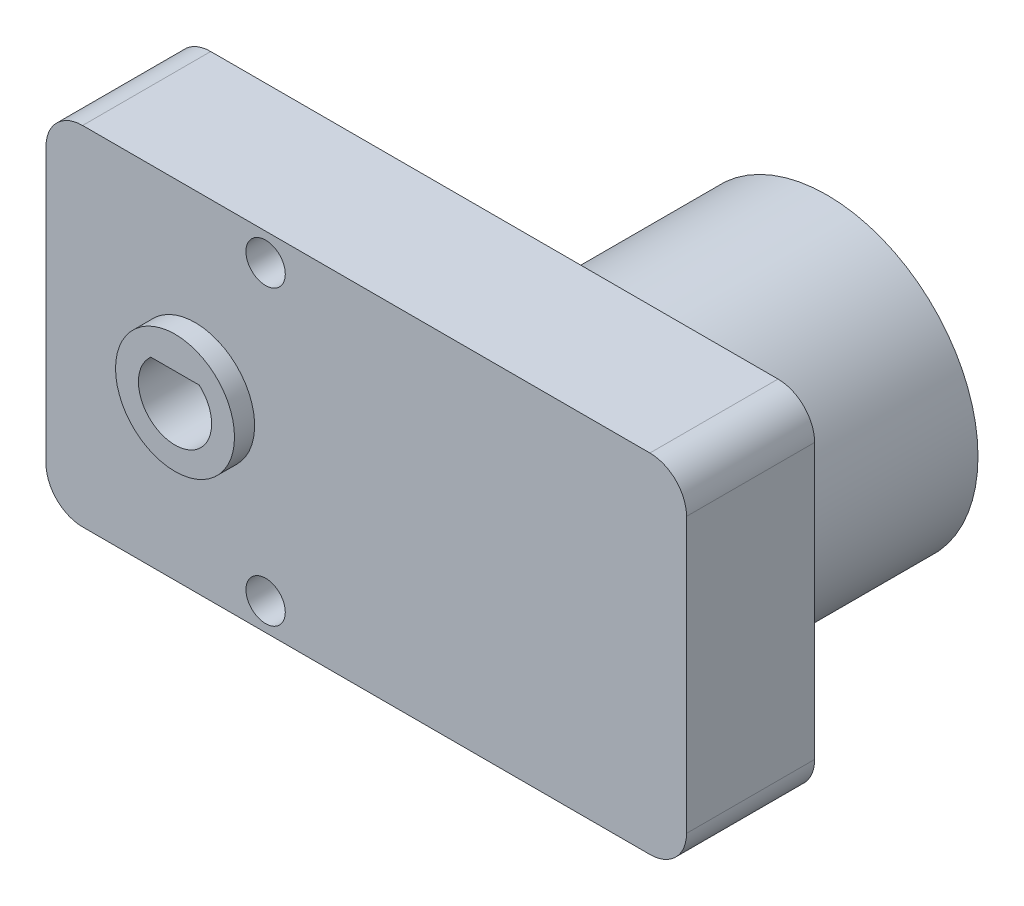
from build123d import *

# Parameters (mm, degrees)
SKETCH1_W           = 70
SKETCH1_H           = 38
SKETCH1_R           = 2.15
BOSS_EXTRUDE1_DEPTH = 14
FILLET1_R           = 4
SKETCH2_R           = 16.5
BOSS_EXTRUDE2_DEPTH = 22.6
BOSS_EXTRUDE3_START = 2.2
SKETCH3_R           = 6.5
BOSS_EXTRUDE3_DEPTH = 2.2
SKETCH4_R           = 6.5
BOSS_EXTRUDE4_DEPTH = 2.2


with BuildPart() as part:
    # Sketch1 → Boss-Extrude1 (new body)
    with BuildSketch(Plane.XY):
        with Locations((35, 19)):
            Rectangle(SKETCH1_W, SKETCH1_H)
        with Locations((24, 35)):
            Circle(SKETCH1_R, mode=Mode.SUBTRACT)
        with Locations((24, 3)):
            Circle(SKETCH1_R, mode=Mode.SUBTRACT)
        with BuildLine():
            Line((13.654248689, 22), (18.945751311, 22))
            ThreePointArc((18.945751311, 22), (16.3, 15), (13.654248689, 22))
        make_face(mode=Mode.SUBTRACT)
    extrude(amount=BOSS_EXTRUDE1_DEPTH)

    # Fillet1
    fillet1_edges = [part.edges().sort_by_distance(p)[0] for p in [
        (0, 38, 7),
        (70, 38, 7),
        (70, 0, 7),
        (0, 0, 7),
    ]]
    fillet(fillet1_edges, radius=FILLET1_R)

    # Sketch2 → Boss-Extrude2 (add)
    with BuildSketch(Plane(origin=(0, 0, 0), x_dir=(-1, 0, 0), z_dir=(0, 0, -1))):
        with Locations((-48.753788749, 19)):
            Circle(SKETCH2_R)
    extrude(amount=BOSS_EXTRUDE2_DEPTH)

    # Sketch3 → Boss-Extrude3 (add)
    with BuildSketch(Plane(origin=(0, 0, 0), x_dir=(-1, 0, 0), z_dir=(0, 0, -1)).offset(BOSS_EXTRUDE3_START)):
        with Locations((-16.3, 19)):
            Circle(SKETCH3_R)
        with BuildLine():
            Line((-18.945751311, 22), (-13.654248689, 22))
            ThreePointArc((-13.654248689, 22), (-16.3, 15), (-18.945751311, 22))
        make_face(mode=Mode.SUBTRACT)
    extrude(amount=-BOSS_EXTRUDE3_DEPTH)

    # Sketch4 → Boss-Extrude4 (add)
    with BuildSketch(Plane.XY.offset(14)):
        with Locations(Location((16.3, 19, 0), (0, 0, 180))):
            Circle(SKETCH4_R)
        with BuildLine():
            Line((13.654248689, 22), (18.945751311, 22))
            ThreePointArc((18.945751311, 22), (16.3, 15), (13.654248689, 22))
        make_face(mode=Mode.SUBTRACT)
    extrude(amount=BOSS_EXTRUDE4_DEPTH)


solid = part.part
